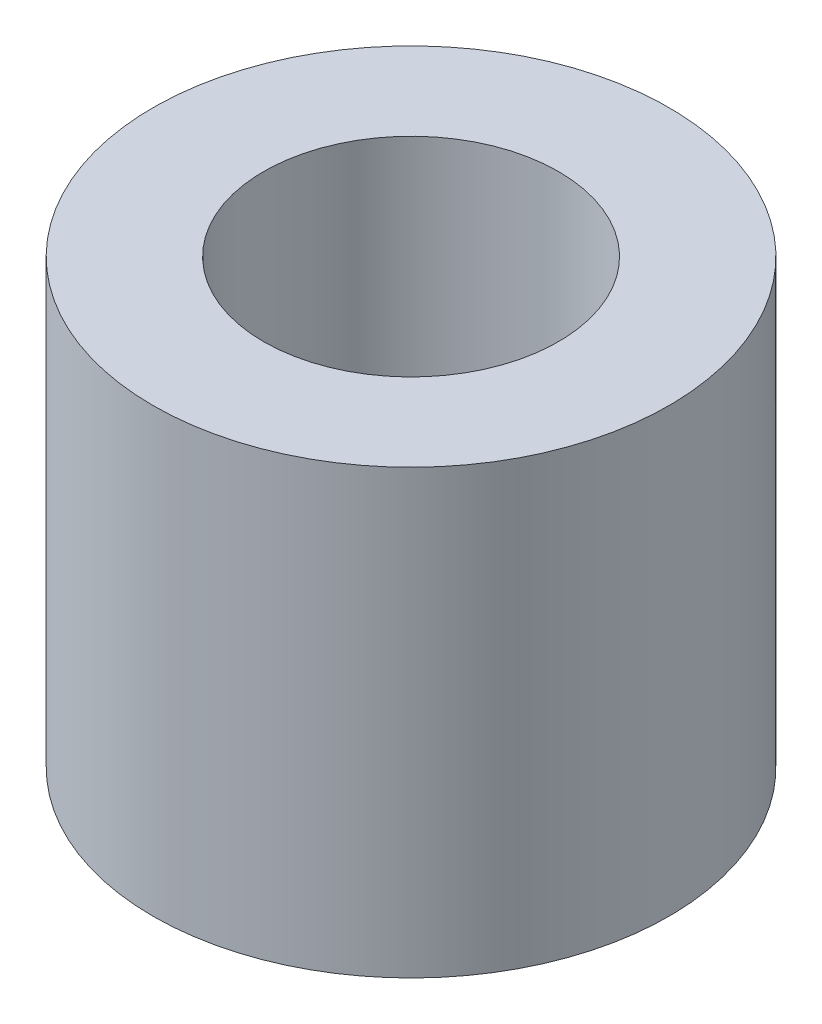
from build123d import *

# Parameters (mm, degrees)
SKETCH_1_R      = 1.75
SKETCH_1_R_2    = 1
EXTRUDE_1_DEPTH = 3


with BuildPart() as part:
    # 草图1 → 凸台-拉伸1 (new body)
    with BuildSketch(Plane(origin=(0, 0, 0), x_dir=(1, 0, 0), z_dir=(0, 1, 0))):
        with Locations(Location((0, 0, 0), (0, 0, 270))):
            Circle(SKETCH_1_R)
        with Locations(Location((0, 0, 0), (0, 0, 270))):
            Circle(SKETCH_1_R_2, mode=Mode.SUBTRACT)
    extrude(amount=EXTRUDE_1_DEPTH)


solid = part.part
